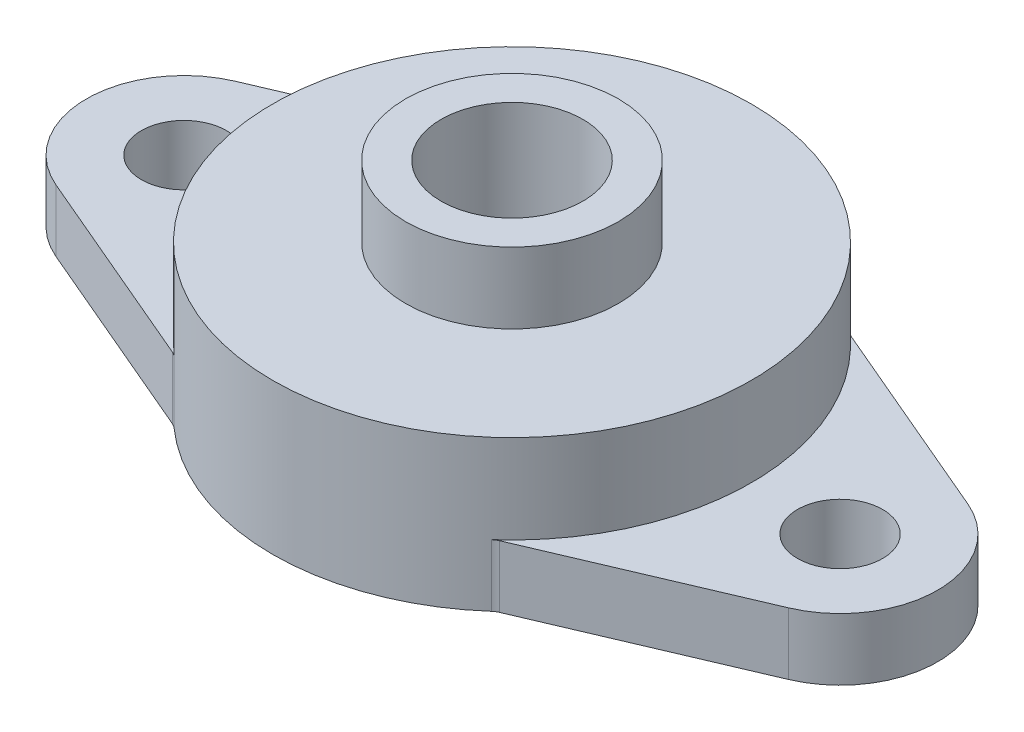
from build123d import *

# Parameters (mm, degrees)
BOSS_EXTRUDE1_DEPTH = 3.5
SKETCH2_R           = 13.5
BOSS_EXTRUDE2_DEPTH = 5
SKETCH3_R           = 6
BOSS_EXTRUDE3_DEPTH = 4
SKETCH4_R           = 4
CUT_EXTRUDE1_DEPTH  = 31.24070105
SKETCH5_R           = 2.4
CUT_EXTRUDE2_DEPTH  = 29.969811874


with BuildPart() as part:
    # Sketch1 → Boss-Extrude1 (new body)
    with BuildSketch(Plane(origin=(0, 0, 0), x_dir=(1, 0, 0), z_dir=(0, 1, 0))):
        with BuildLine():
            Line((-20.657112668, 5.059334436), (-9.221211054, 9.935178986))
            ThreePointArc((-9.221211054, 9.935178986), (-9.078911878, 10.009890435), (-8.950419333, 10.106433286))
            ThreePointArc((-8.950419333, 10.106433286), (0, 13.5), (8.950419333, 10.106433286))
            ThreePointArc((8.950419333, 10.106433286), (9.078911878, 10.009890435), (9.221211054, 9.935178986))
            Line((9.221211054, 9.935178986), (20.657112668, 5.059334436))
            ThreePointArc((20.657112668, 5.059334436), (24, 0), (20.657112668, -5.059334436))
            Line((20.657112668, -5.059334436), (9.221211054, -9.935178986))
            ThreePointArc((9.221211054, -9.935178986), (9.078911878, -10.009890435), (8.950419333, -10.106433286))
            ThreePointArc((8.950419333, -10.106433286), (0, -13.5), (-8.950419333, -10.106433286))
            ThreePointArc((-8.950419333, -10.106433286), (-9.078911878, -10.009890435), (-9.221211054, -9.935178986))
            Line((-9.221211054, -9.935178986), (-20.657112668, -5.059334436))
            ThreePointArc((-20.657112668, -5.059334436), (-24, 0), (-20.657112668, 5.059334436))
        make_face()
    extrude(amount=BOSS_EXTRUDE1_DEPTH)

    # Sketch2 → Boss-Extrude2 (add)
    with BuildSketch(Plane(origin=(0, 3.5, 0), x_dir=(1, 0, 0), z_dir=(0, 1, 0))):
        with Locations(Location((0, 0, 0), (0, 0, 131.528615852))):
            Circle(SKETCH2_R)
    extrude(amount=BOSS_EXTRUDE2_DEPTH)

    # Sketch3 → Boss-Extrude3 (add)
    with BuildSketch(Plane(origin=(0, 8.5, 0), x_dir=(1, 0, 0), z_dir=(0, 1, 0))):
        with Locations(Location((0, 0, 0), (0, 0, 270))):
            Circle(SKETCH3_R)
    extrude(amount=BOSS_EXTRUDE3_DEPTH)

    # Sketch4 → Cut-Extrude1 (cut, through all)
    with BuildSketch(Plane(origin=(0, 12.5, 0), x_dir=(1, 0, 0), z_dir=(0, 1, 0))):
        with Locations(Location((0, 0, 0), (0, 0, 270))):
            Circle(SKETCH4_R)
    extrude(amount=-CUT_EXTRUDE1_DEPTH, mode=Mode.SUBTRACT)

    # Sketch5 → Cut-Extrude2 (cut, through all)
    with BuildSketch(Plane(origin=(0, 3.5, 0), x_dir=(1, 0, 0), z_dir=(0, 1, 0))):
        with Locations(Location((-18.5, 0, 0), (0, 0, 270))):
            Circle(SKETCH5_R)
        with Locations(Location((18.5, 0, 0), (0, 0, 270))):
            Circle(SKETCH5_R)
    extrude(amount=-CUT_EXTRUDE2_DEPTH, mode=Mode.SUBTRACT)


solid = part.part
